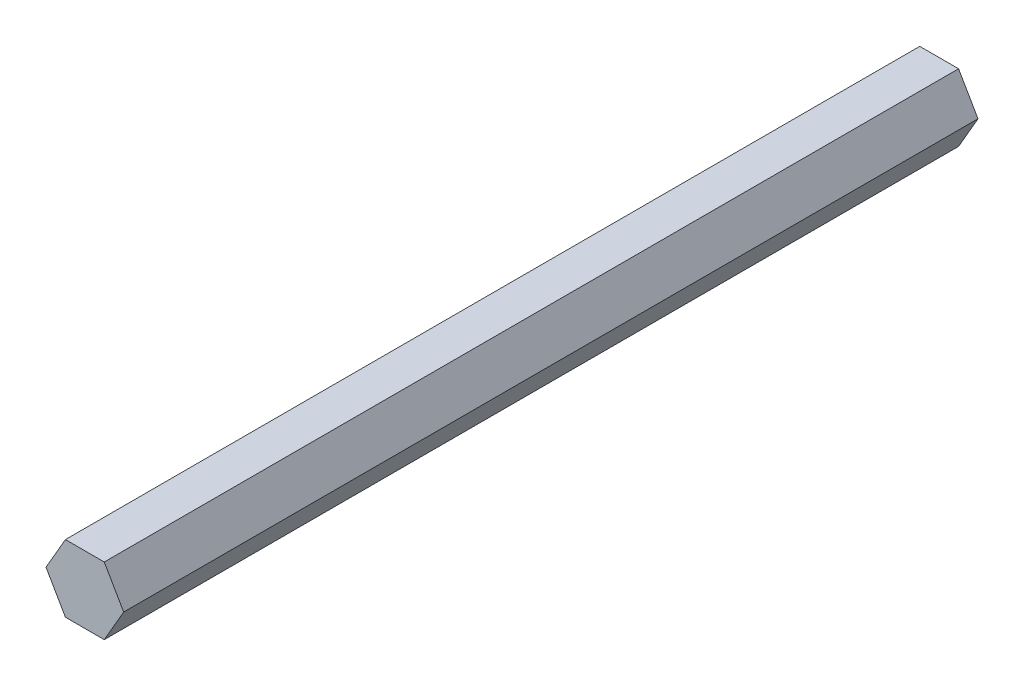
from build123d import *

# Parameters (mm, degrees)
BOSS_EXTRUDE1_DEPTH = 38.1


with BuildPart() as part:
    # Sketch1 → Boss-Extrude1 (new body)
    with BuildSketch(Plane.XY):
        Polygon((1.732050808, 0), (0.866025404, 1.5), (-0.866025404, 1.5), (-1.732050808, 0), (-0.866025404, -1.5), (0.866025404, -1.5), align=None)
    extrude(amount=BOSS_EXTRUDE1_DEPTH)


solid = part.part
